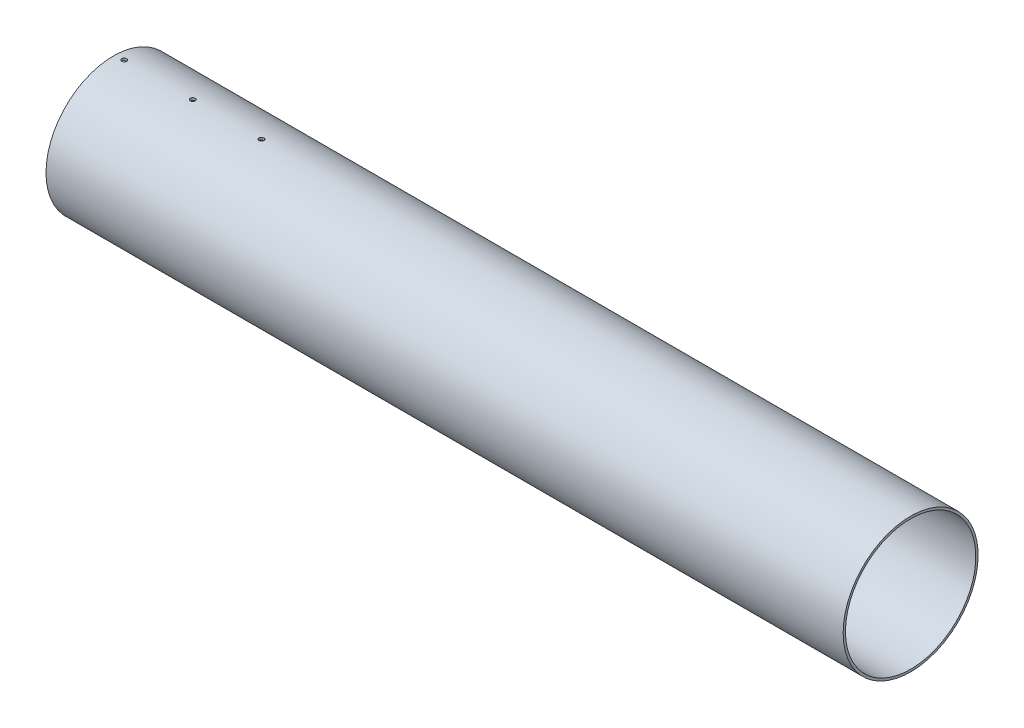
from build123d import *

# Parameters (mm, degrees)
ESQUISSE1_W          = 900
ESQUISSE1_H          = 2.5908
D_GAGEMENT_M51_D     = 5.5
D_GAGEMENT_M51_DEPTH = 10
D_GAGEMENT_M51_TIP   = 1.652366702


with BuildPart() as part:
    # Esquisse1 → Révolution1 (revolve)
    with BuildSketch(Plane.XY, mode=Mode.PRIVATE) as r_volution1_sk:
        with Locations((450, 74.9046)):
            Rectangle(ESQUISSE1_W, ESQUISSE1_H)
    revolve(r_volution1_sk.sketch.rotate(Axis((0, 0, 0), (1, 0, 0)), 90), axis=Axis((0, 0, 0), (1, 0, 0)))

    # Dégagement M51
    with Locations(Plane(origin=(0, 76.2, 0), x_dir=(1, 0, 0), z_dir=(0, 1, 0))):
        with Locations((165, 2.06190404), (87.5, 2.06190404), (10, 2.06190404)):
            Hole(D_GAGEMENT_M51_D / 2, depth=D_GAGEMENT_M51_DEPTH)
            with Locations((0, 0, -(D_GAGEMENT_M51_DEPTH + D_GAGEMENT_M51_TIP / 2))):  # 118° drill point
                Cone(0, D_GAGEMENT_M51_D / 2, D_GAGEMENT_M51_TIP, mode=Mode.SUBTRACT)


solid = part.part
